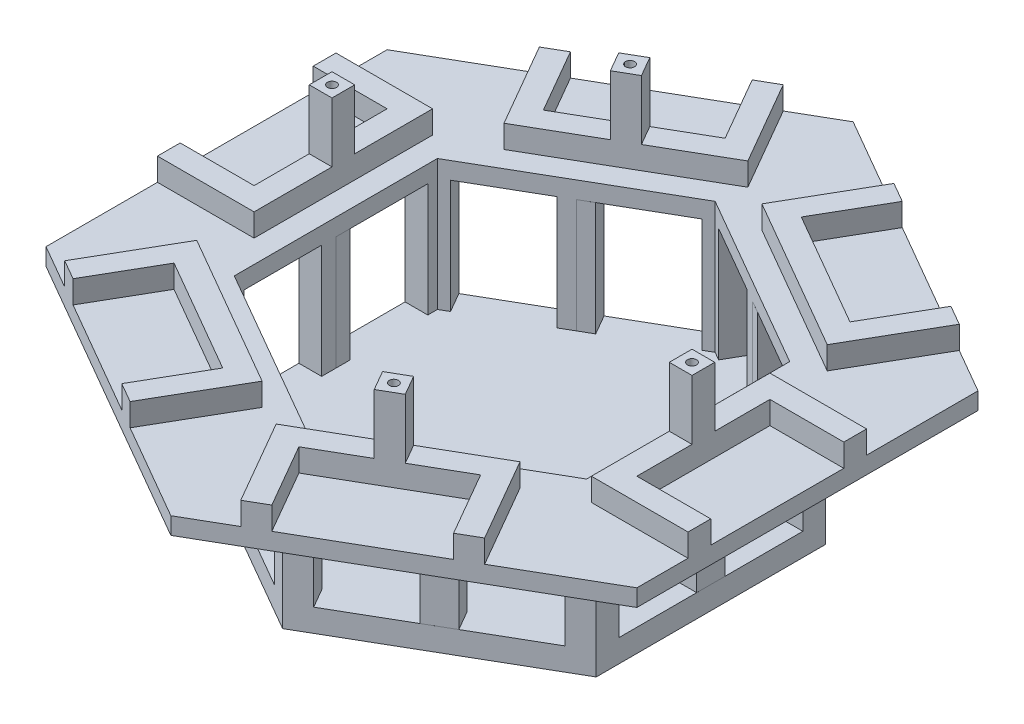
from build123d import *

# Parameters (mm, degrees)
BOSS_EXTRUDE1_DEPTH  = 3
BOSS_EXTRUDE2_DEPTH  = 4
SKETCH5_W            = 4
SKETCH5_H            = 4
BOSS_EXTRUDE3_DEPTH  = 10.5
SKETCH7_R            = 2.4
BOSS_EXTRUDE4_DEPTH  = 3
SKETCH9_R            = 0.8
CUT_EXTRUDE6_DEPTH   = 5
BOSS_EXTRUDE10_DEPTH = 24
CUT_EXTRUDE7_DEPTH   = 23
CUT_EXTRUDE10_START  = -24
SKETCH24_W           = 32.370082298
SKETCH24_H           = 20
CUT_EXTRUDE10_DEPTH  = 133.325180249
CIRPATTERN1_COUNT    = 6
BOSS_EXTRUDE11_DEPTH = 20
CIRPATTERN2_COUNT    = 6


with BuildPart() as part:
    # Sketch1 → Boss-Extrude1 (new body)
    with BuildSketch(Plane(origin=(0, 0, 0), x_dir=(1, 0, 0), z_dir=(0, 1, 0))):
        Polygon((0, 60), (-51.961524227, 30), (-51.961524227, -30), (0, -60), (51.961524227, -30), (51.961524227, 30), align=None)
    extrude(amount=BOSS_EXTRUDE1_DEPTH)

    # Sketch2 → Boss-Extrude2 (add)
    with BuildSketch(Plane(origin=(0, 3, 0), x_dir=(1, 0, 0), z_dir=(0, 1, 0))):
        Polygon((35.667295593, 19.777568136), (44.167295593, 34.5), (40.703193978, 36.5), (34.203193978, 25.241669751), (19.480762114, 33.741669751), (13.938199529, 36.941669751), (20.438199529, 48.2), (16.974097914, 50.2), (8.474097914, 35.477568136), (17.480762114, 30.277568136), align=None)
        Polygon((51.961524227, -17), (51.961524227, -21), (34.961524227, -21), (34.961524227, 0), (34.961524227, 10.4), (51.961524227, 10.4), (51.961524227, 6.4), (38.961524227, 6.4), (38.961524227, 0), (38.961524227, -17), align=None)
        Polygon((11.258330249, -53.5), (7.794228634, -55.5), (-0.705771366, -40.777568136), (17.480762114, -30.277568136), (26.487426313, -25.077568136), (34.987426313, -39.8), (31.523324698, -41.8), (25.023324698, -30.541669751), (19.480762114, -33.741669751), (4.758330249, -42.241669751), align=None)
        Polygon((-40.703193978, -36.5), (-44.167295593, -34.5), (-35.667295593, -19.777568136), (-17.480762114, -30.277568136), (-8.474097914, -35.477568136), (-16.974097914, -50.2), (-20.438199529, -48.2), (-13.938199529, -36.941669751), (-19.480762114, -33.741669751), (-34.203193978, -25.241669751), align=None)
        Polygon((-51.961524227, 17), (-51.961524227, 21), (-34.961524227, 21), (-34.961524227, 0), (-34.961524227, -10.4), (-51.961524227, -10.4), (-51.961524227, -6.4), (-38.961524227, -6.4), (-38.961524227, 0), (-38.961524227, 17), align=None)
        Polygon((-11.258330249, 53.5), (-7.794228634, 55.5), (0.705771366, 40.777568136), (-17.480762114, 30.277568136), (-26.487426313, 25.077568136), (-34.987426313, 39.8), (-31.523324698, 41.8), (-25.023324698, 30.541669751), (-19.480762114, 33.741669751), (-4.758330249, 42.241669751), align=None)
    extrude(amount=BOSS_EXTRUDE2_DEPTH)

    # Sketch5 → Boss-Extrude3 (add)
    with BuildSketch(Plane(origin=(0, 7, 0), x_dir=(1, 0, 0), z_dir=(0, 1, 0))):
        with Locations((36.961524227, -5.3)):
            Rectangle(SKETCH5_W, SKETCH5_H)
        Polygon((14.622878281, -31.927568136), (11.158776666, -33.927568136), (13.158776666, -37.391669751), (16.622878281, -35.391669751), align=None)
        with Locations((-36.961524227, 5.3)):
            Rectangle(SKETCH5_W, SKETCH5_H)
        Polygon((-14.622878281, 31.927568136), (-11.158776666, 33.927568136), (-13.158776666, 37.391669751), (-16.622878281, 35.391669751), align=None)
    extrude(amount=BOSS_EXTRUDE3_DEPTH)

    # Sketch7 → Boss-Extrude4 (add)
    with BuildSketch(Plane.XZ):
        with Locations((22.730762114, 39.370834875)):
            Circle(SKETCH7_R)
        with Locations((45.461524227, 0)):
            Circle(SKETCH7_R)
        with Locations((22.730762114, -39.370834875)):
            Circle(SKETCH7_R)
        with Locations((-22.730762114, -39.370834875)):
            Circle(SKETCH7_R)
        with Locations((-45.461524227, 0)):
            Circle(SKETCH7_R)
        with Locations((-22.730762114, 39.370834875)):
            Circle(SKETCH7_R)
    extrude(amount=BOSS_EXTRUDE4_DEPTH)

    # Sketch9 → Cut-Extrude6 (cut)
    with BuildSketch(Plane(origin=(0, 17.5, 0), x_dir=(1, 0, 0), z_dir=(0, 1, 0))):
        with Locations((-36.961524227, 5.3)):
            Circle(SKETCH9_R)
        with Locations((-13.890827473, 34.659618943)):
            Circle(SKETCH9_R)
        with Locations((23.070696754, 29.359618943)):
            Circle(SKETCH9_R)
        with Locations((36.961524227, -5.3)):
            Circle(SKETCH9_R)
        with Locations((13.890827473, -34.659618943)):
            Circle(SKETCH9_R)
        with Locations((-23.070696754, -29.359618943)):
            Circle(SKETCH9_R)
    extrude(amount=-CUT_EXTRUDE6_DEPTH, mode=Mode.SUBTRACT)

    # Sketch22 → Boss-Extrude10 (add)
    with BuildSketch(Plane.XZ):
        Polygon((-34.948372872, 20.207790041), (-34.974645966, -20.162283708), (-0.026273093, -40.370073749), (34.948372872, -20.207790041), (34.974645966, 20.162283708), (0.026273093, 40.370073749), align=None)
    extrude(amount=BOSS_EXTRUDE10_DEPTH)

    # Sketch23 → Cut-Extrude7 (cut)
    with BuildSketch(Plane(origin=(0, 3, 0), x_dir=(1, 0, 0), z_dir=(0, 1, 0))):
        Polygon((-0.023267149, 35.751272573), (-30.973143841, 17.855486345), (-30.949876692, -17.895786229), (0.023267149, -35.751272573), (30.973143841, -17.855486345), (30.949876692, 17.895786229), align=None)
    extrude(amount=-CUT_EXTRUDE7_DEPTH, mode=Mode.SUBTRACT)

    # Sketch24 → Cut-Extrude10 (cut)
    with BuildSketch(Plane(origin=(34.961509419, 0, -0.022753166), x_dir=(-0.0006508060386860347, 0, -0.9999997882257277), z_dir=(0.9999997882257275, 0, -0.0006508060386860346)).offset(CUT_EXTRUDE10_START)):
        with Locations((0, -10)):
            Rectangle(SKETCH24_W, SKETCH24_H)
    cut_extrude10 = extrude(amount=CUT_EXTRUDE10_DEPTH, mode=Mode.SUBTRACT)

    # CirPattern1: Cut-Extrude10 ×6 about axis
    cirpattern1_axis = Axis((0, 0, 0), (0, 1, 0))
    for i in range(1, CIRPATTERN1_COUNT):
        add(cut_extrude10.rotate(cirpattern1_axis, i * 360 / CIRPATTERN1_COUNT), mode=Mode.SUBTRACT)

    # Sketch25 → Boss-Extrude11 (add)
    with BuildSketch(Plane(origin=(0, -20, 0), x_dir=(1, 0, 0), z_dir=(0, 1, 0))):
        Polygon((15.498205495, -26.803379459), (17.662455038, -25.551970687), (19.66553091, -29.016191283), (15.330894041, -31.518795046), (13.332328936, -28.051970158), align=None)
    boss_extrude11 = extrude(amount=BOSS_EXTRUDE11_DEPTH)

    # CirPattern2: Boss-Extrude11 ×6 about axis
    cirpattern2_axis = Axis((0, 0, 0), (0, 1, 0))
    for i in range(1, CIRPATTERN2_COUNT):
        add(boss_extrude11.rotate(cirpattern2_axis, i * 360 / CIRPATTERN2_COUNT))


solid = part.part
